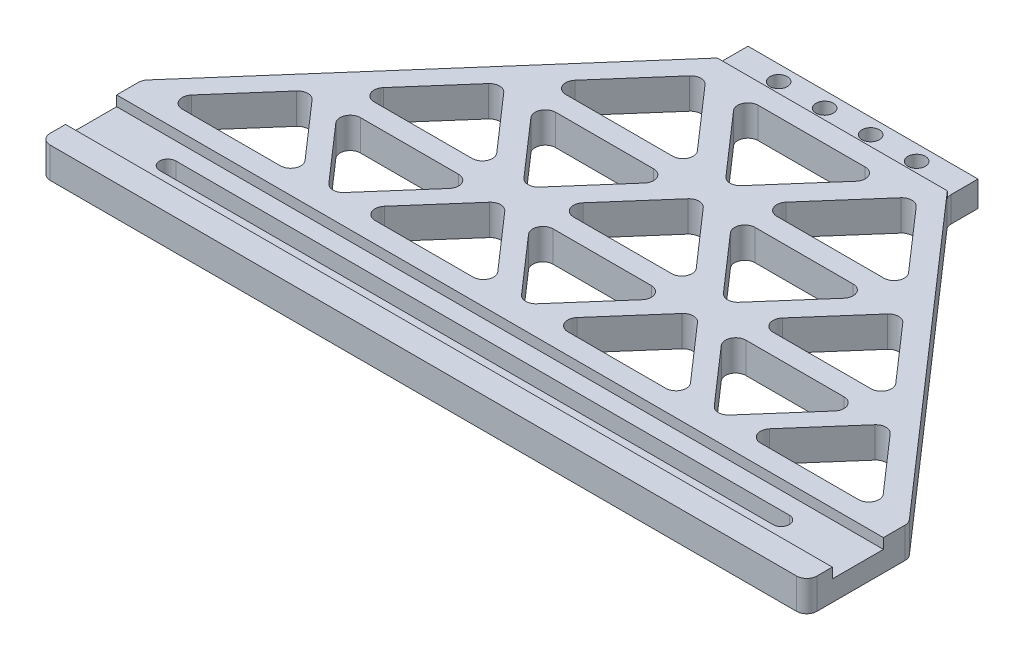
from build123d import *

# Parameters (mm, degrees)
EXTRUDE_1_DEPTH     = 6
SKETCH_2_W          = 150
SKETCH_2_H          = 10
CUT_EXTRUDE_1_DEPTH = 2
SKETCH_3_W          = 45
SKETCH_3_H          = 6
CUT_EXTRUDE_2_DEPTH = 1
HOLE_WIZARD_M31_D   = 3.4
CUT_EXTRUDE_3_DEPTH = 112.937482552
CUT_EXTRUDE_4_REACH = 114.027
FILLET_1_R          = 2


with BuildPart() as part:
    # Эскиз1 → Бобышка-Вытянуть1 (new body)
    with BuildSketch(Plane(origin=(0, 0, 0), x_dir=(1, 0, 0), z_dir=(0, 1, 0))):
        Polygon((-22.5, 3), (22.5, 3), (22.5, -3), (75, -63), (75, -83), (-75, -83), (-75, -63), (-22.5, -3), align=None)
    extrude(amount=EXTRUDE_1_DEPTH)

    # Эскиз2 → Вырез-Вытянуть1 (cut)
    with BuildSketch(Plane(origin=(0, 6, 0), x_dir=(1, 0, 0), z_dir=(0, 1, 0))):
        with Locations((0, -73)):
            Rectangle(SKETCH_2_W, SKETCH_2_H)
    extrude(amount=-CUT_EXTRUDE_1_DEPTH, mode=Mode.SUBTRACT)

    # Эскиз3 → Вырез-Вытянуть2 (cut)
    with BuildSketch(Plane(origin=(0, 6, 0), x_dir=(1, 0, 0), z_dir=(0, 1, 0))):
        Rectangle(SKETCH_3_W, SKETCH_3_H)
    extrude(amount=-CUT_EXTRUDE_2_DEPTH, mode=Mode.SUBTRACT)

    # Отверстие с зазором M31 (through all)
    with Locations(Plane(origin=(0, 0, 0), x_dir=(-1, 0, 0), z_dir=(0, -1, 0))):
        with Locations((-13.5, 0), (-4.5, 0), (4.5, 0), (13.5, 0)):
            Hole(HOLE_WIZARD_M31_D / 2)

    # Эскиз9 → Вырез-Вытянуть3 (cut, through all)
    with BuildSketch(Plane(origin=(0, 4, 0), x_dir=(1, 0, 0), z_dir=(0, 1, 0))):
        with BuildLine():
            Line((-60, -71.4), (60, -71.4))
            ThreePointArc((60, -71.4), (61.6, -73), (60, -74.6))
            Line((60, -74.6), (-60, -74.6))
            ThreePointArc((-60, -74.6), (-61.6, -73), (-60, -71.4))
        make_face()
    extrude(amount=-CUT_EXTRUDE_3_DEPTH, mode=Mode.SUBTRACT)

    # Эскиз10 → Вырез-Вытянуть4 (cut, up to next)
    with BuildSketch(Plane(origin=(0, 6, 0), x_dir=(1, 0, 0), z_dir=(0, 1, 0)), mode=Mode.PRIVATE) as cut_extrude_4_sk1:
        Polygon((-70.559927094, -64), (-56.559927094, -48), (-42.559927094, -64), align=None)
    cut_extrude_4_tool1 = extrude(cut_extrude_4_sk1.sketch, amount=-CUT_EXTRUDE_4_REACH, mode=Mode.PRIVATE) & part.part
    # Эскиз10 → Вырез-Вытянуть4 (cut, up to next)
    with BuildSketch(Plane(origin=(0, 6, 0), x_dir=(1, 0, 0), z_dir=(0, 1, 0)), mode=Mode.PRIVATE) as cut_extrude_4_sk2:
        Polygon((-51.709923067, -48), (-37.709923067, -64), (-23.709923067, -48), align=None)
    cut_extrude_4_tool2 = extrude(cut_extrude_4_sk2.sketch, amount=-CUT_EXTRUDE_4_REACH, mode=Mode.PRIVATE) & part.part
    # Эскиз10 → Вырез-Вытянуть4 (cut, up to next)
    with BuildSketch(Plane(origin=(0, 6, 0), x_dir=(1, 0, 0), z_dir=(0, 1, 0)), mode=Mode.PRIVATE) as cut_extrude_4_sk3:
        Polygon((-18.85991904, -48), (-32.85991904, -64), (-4.85991904, -64), align=None)
    cut_extrude_4_tool3 = extrude(cut_extrude_4_sk3.sketch, amount=-CUT_EXTRUDE_4_REACH, mode=Mode.PRIVATE) & part.part
    # Эскиз10 → Вырез-Вытянуть4 (cut, up to next)
    with BuildSketch(Plane(origin=(0, 6, 0), x_dir=(1, 0, 0), z_dir=(0, 1, 0)), mode=Mode.PRIVATE) as cut_extrude_4_sk4:
        Polygon((-14.009915012, -48), (-0.009915012, -64), (13.990084988, -48), align=None)
    cut_extrude_4_tool4 = extrude(cut_extrude_4_sk4.sketch, amount=-CUT_EXTRUDE_4_REACH, mode=Mode.PRIVATE) & part.part
    # Эскиз10 → Вырез-Вытянуть4 (cut, up to next)
    with BuildSketch(Plane(origin=(0, 6, 0), x_dir=(1, 0, 0), z_dir=(0, 1, 0)), mode=Mode.PRIVATE) as cut_extrude_4_sk5:
        Polygon((18.840089015, -48), (4.840089015, -64), (32.840089015, -64), align=None)
    cut_extrude_4_tool5 = extrude(cut_extrude_4_sk5.sketch, amount=-CUT_EXTRUDE_4_REACH, mode=Mode.PRIVATE) & part.part
    # Эскиз10 → Вырез-Вытянуть4 (cut, up to next)
    with BuildSketch(Plane(origin=(0, 6, 0), x_dir=(1, 0, 0), z_dir=(0, 1, 0)), mode=Mode.PRIVATE) as cut_extrude_4_sk6:
        Polygon((23.690093042, -48), (37.690093042, -64), (51.690093042, -48), align=None)
    cut_extrude_4_tool6 = extrude(cut_extrude_4_sk6.sketch, amount=-CUT_EXTRUDE_4_REACH, mode=Mode.PRIVATE) & part.part
    # Эскиз10 → Вырез-Вытянуть4 (cut, up to next)
    with BuildSketch(Plane(origin=(0, 6, 0), x_dir=(1, 0, 0), z_dir=(0, 1, 0)), mode=Mode.PRIVATE) as cut_extrude_4_sk7:
        Polygon((42.540097069, -64), (70.540097069, -64), (56.540097069, -48), align=None)
    cut_extrude_4_tool7 = extrude(cut_extrude_4_sk7.sketch, amount=-CUT_EXTRUDE_4_REACH, mode=Mode.PRIVATE) & part.part
    # Эскиз10 → Вырез-Вытянуть4 (cut, up to next)
    with BuildSketch(Plane(origin=(0, 6, 0), x_dir=(1, 0, 0), z_dir=(0, 1, 0)), mode=Mode.PRIVATE) as cut_extrude_4_sk8:
        Polygon((-53.059927094, -44), (-39.059927094, -28), (-25.059927094, -44), align=None)
    cut_extrude_4_tool8 = extrude(cut_extrude_4_sk8.sketch, amount=-CUT_EXTRUDE_4_REACH, mode=Mode.PRIVATE) & part.part
    # Эскиз10 → Вырез-Вытянуть4 (cut, up to next)
    with BuildSketch(Plane(origin=(0, 6, 0), x_dir=(1, 0, 0), z_dir=(0, 1, 0)), mode=Mode.PRIVATE) as cut_extrude_4_sk9:
        Polygon((-33.545538953, -28), (-19.545538953, -44), (-5.545538953, -28), align=None)
    cut_extrude_4_tool9 = extrude(cut_extrude_4_sk9.sketch, amount=-CUT_EXTRUDE_4_REACH, mode=Mode.PRIVATE) & part.part
    # Эскиз10 → Вырез-Вытянуть4 (cut, up to next)
    with BuildSketch(Plane(origin=(0, 6, 0), x_dir=(1, 0, 0), z_dir=(0, 1, 0)), mode=Mode.PRIVATE) as cut_extrude_4_sk10:
        Polygon((-0.031150813, -28), (-14.031150813, -44), (13.968849187, -44), align=None)
    cut_extrude_4_tool10 = extrude(cut_extrude_4_sk10.sketch, amount=-CUT_EXTRUDE_4_REACH, mode=Mode.PRIVATE) & part.part
    # Эскиз10 → Вырез-Вытянуть4 (cut, up to next)
    with BuildSketch(Plane(origin=(0, 6, 0), x_dir=(1, 0, 0), z_dir=(0, 1, 0)), mode=Mode.PRIVATE) as cut_extrude_4_sk11:
        Polygon((5.483237327, -28), (19.483237327, -44), (33.483237327, -28), align=None)
    cut_extrude_4_tool11 = extrude(cut_extrude_4_sk11.sketch, amount=-CUT_EXTRUDE_4_REACH, mode=Mode.PRIVATE) & part.part
    # Эскиз10 → Вырез-Вытянуть4 (cut, up to next)
    with BuildSketch(Plane(origin=(0, 6, 0), x_dir=(1, 0, 0), z_dir=(0, 1, 0)), mode=Mode.PRIVATE) as cut_extrude_4_sk12:
        Polygon((24.997625468, -44), (38.997625468, -28), (52.997625468, -44), align=None)
    cut_extrude_4_tool12 = extrude(cut_extrude_4_sk12.sketch, amount=-CUT_EXTRUDE_4_REACH, mode=Mode.PRIVATE) & part.part
    # Эскиз10 → Вырез-Вытянуть4 (cut, up to next)
    with BuildSketch(Plane(origin=(0, 6, 0), x_dir=(1, 0, 0), z_dir=(0, 1, 0)), mode=Mode.PRIVATE) as cut_extrude_4_sk13:
        Polygon((-35.559927094, -24), (-20.684927094, -7), (-5.809927094, -24), align=None)
    cut_extrude_4_tool13 = extrude(cut_extrude_4_sk13.sketch, amount=-CUT_EXTRUDE_4_REACH, mode=Mode.PRIVATE) & part.part
    # Эскиз10 → Вырез-Вытянуть4 (cut, up to next)
    with BuildSketch(Plane(origin=(0, 6, 0), x_dir=(1, 0, 0), z_dir=(0, 1, 0)), mode=Mode.PRIVATE) as cut_extrude_4_sk14:
        Polygon((-14.904785308, -7), (-0.029785308, -24), (14.845214692, -7), align=None)
    cut_extrude_4_tool14 = extrude(cut_extrude_4_sk14.sketch, amount=-CUT_EXTRUDE_4_REACH, mode=Mode.PRIVATE) & part.part
    # Эскиз10 → Вырез-Вытянуть4 (cut, up to next)
    with BuildSketch(Plane(origin=(0, 6, 0), x_dir=(1, 0, 0), z_dir=(0, 1, 0)), mode=Mode.PRIVATE) as cut_extrude_4_sk15:
        Polygon((20.625356478, -7), (5.750356478, -24), (35.500356478, -24), align=None)
    cut_extrude_4_tool15 = extrude(cut_extrude_4_sk15.sketch, amount=-CUT_EXTRUDE_4_REACH, mode=Mode.PRIVATE) & part.part
    add(cut_extrude_4_tool1.solids().sort_by_distance((-56.559927, 6, 58.666667))[0], mode=Mode.SUBTRACT)
    add(cut_extrude_4_tool2.solids().sort_by_distance((-37.709923, 6, 53.333333))[0], mode=Mode.SUBTRACT)
    add(cut_extrude_4_tool3.solids().sort_by_distance((-18.859919, 6, 58.666667))[0], mode=Mode.SUBTRACT)
    add(cut_extrude_4_tool4.solids().sort_by_distance((-0.009915, 6, 53.333333))[0], mode=Mode.SUBTRACT)
    add(cut_extrude_4_tool5.solids().sort_by_distance((18.840089, 6, 58.666667))[0], mode=Mode.SUBTRACT)
    add(cut_extrude_4_tool6.solids().sort_by_distance((37.690093, 6, 53.333333))[0], mode=Mode.SUBTRACT)
    add(cut_extrude_4_tool7.solids().sort_by_distance((56.540097, 6, 58.666667))[0], mode=Mode.SUBTRACT)
    add(cut_extrude_4_tool8.solids().sort_by_distance((-39.059927, 6, 38.666667))[0], mode=Mode.SUBTRACT)
    add(cut_extrude_4_tool9.solids().sort_by_distance((-19.545539, 6, 33.333333))[0], mode=Mode.SUBTRACT)
    add(cut_extrude_4_tool10.solids().sort_by_distance((-0.031151, 6, 38.666667))[0], mode=Mode.SUBTRACT)
    add(cut_extrude_4_tool11.solids().sort_by_distance((19.483237, 6, 33.333333))[0], mode=Mode.SUBTRACT)
    add(cut_extrude_4_tool12.solids().sort_by_distance((38.997625, 6, 38.666667))[0], mode=Mode.SUBTRACT)
    add(cut_extrude_4_tool13.solids().sort_by_distance((-20.684927, 6, 18.333333))[0], mode=Mode.SUBTRACT)
    add(cut_extrude_4_tool14.solids().sort_by_distance((-0.029785, 6, 12.666667))[0], mode=Mode.SUBTRACT)
    add(cut_extrude_4_tool15.solids().sort_by_distance((20.625356, 6, 18.333333))[0], mode=Mode.SUBTRACT)

    # Скругление1
    fillet_1_edges = [part.edges().sort_by_distance(p)[0] for p in [
        (-51.709923067, 3, 48),
        (-23.709923067, 3, 48),
        (-37.709923067, 3, 64),
        (-18.85991904, 3, 48),
        (-4.85991904, 3, 64),
        (-32.85991904, 3, 64),
        (-14.009915012, 3, 48),
        (13.990084988, 3, 48),
        (-0.009915012, 3, 64),
        (75, 3, 63),
        (18.840089015, 3, 48),
        (32.840089015, 3, 64),
        (4.840089015, 3, 64),
        (75, 3, 83),
        (-75, 3, 83),
        (-75, 3, 63),
        (23.690093042, 3, 48),
        (51.690093042, 3, 48),
        (37.690093042, 3, 64),
        (-25.059927094, 3, 44),
        (-53.059927094, 3, 44),
        (-39.059927094, 3, 28),
        (42.540097069, 3, 64),
        (56.540097069, 3, 48),
        (70.540097069, 3, 64),
        (-33.545538953, 3, 28),
        (-5.545538953, 3, 28),
        (-19.545538953, 3, 44),
        (-0.031150813, 3, 28),
        (13.968849187, 3, 44),
        (-14.031150813, 3, 44),
        (5.483237327, 3, 28),
        (33.483237327, 3, 28),
        (19.483237327, 3, 44),
        (52.997625468, 3, 44),
        (24.997625468, 3, 44),
        (38.997625468, 3, 28),
        (-5.809927094, 3, 24),
        (-35.559927094, 3, 24),
        (-20.684927094, 3, 7),
        (-14.904785308, 3, 7),
        (14.845214692, 3, 7),
        (-0.029785308, 3, 24),
        (20.625356478, 3, 7),
        (35.500356478, 3, 24),
        (5.750356478, 3, 24),
        (-22.5, 2.5, 3),
        (22.5, 2.5, 3),
        (-42.559927094, 3, 64),
        (-70.559927094, 3, 64),
        (-56.559927094, 3, 48),
    ]]
    fillet(fillet_1_edges, radius=FILLET_1_R)


solid = part.part
